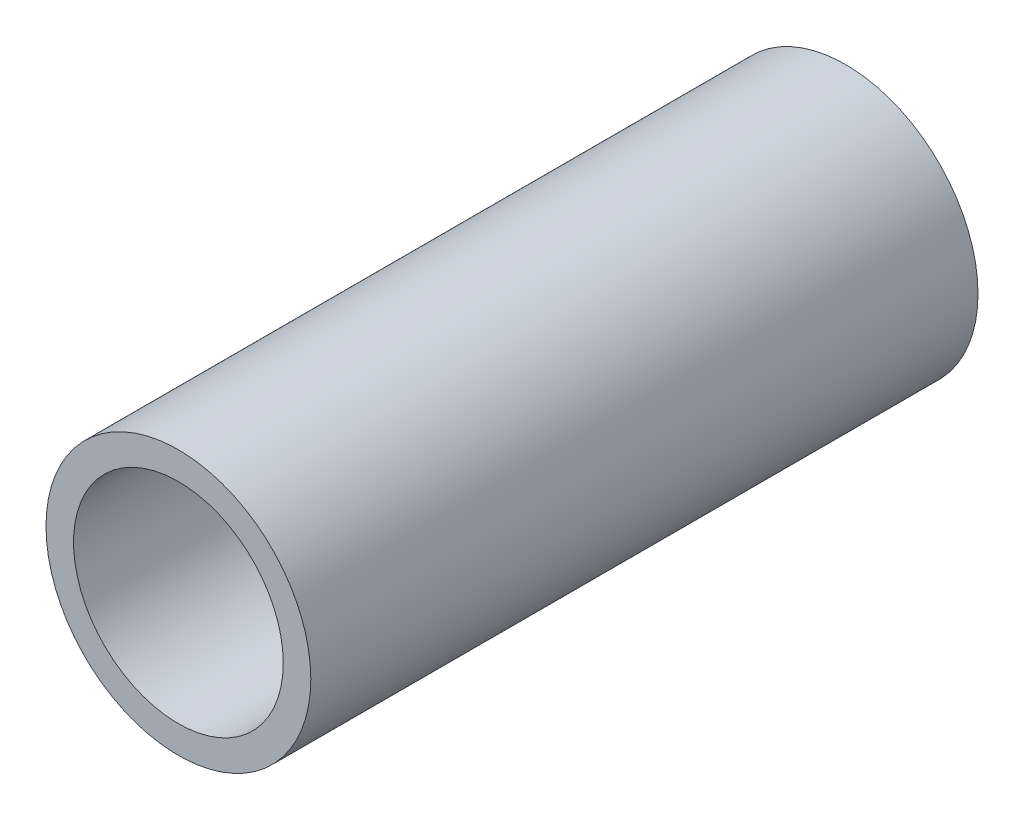
from build123d import *

# Parameters (mm, degrees)
SKETCH1_R           = 7.9375
SKETCH1_R_2         = 6.2865
BOSS_EXTRUDE1_DEPTH = 40


with BuildPart() as part:
    # Sketch1 → Boss-Extrude1 (new body)
    with BuildSketch(Plane.XY):
        Circle(SKETCH1_R)
        Circle(SKETCH1_R_2, mode=Mode.SUBTRACT)
    extrude(amount=BOSS_EXTRUDE1_DEPTH)


solid = part.part
